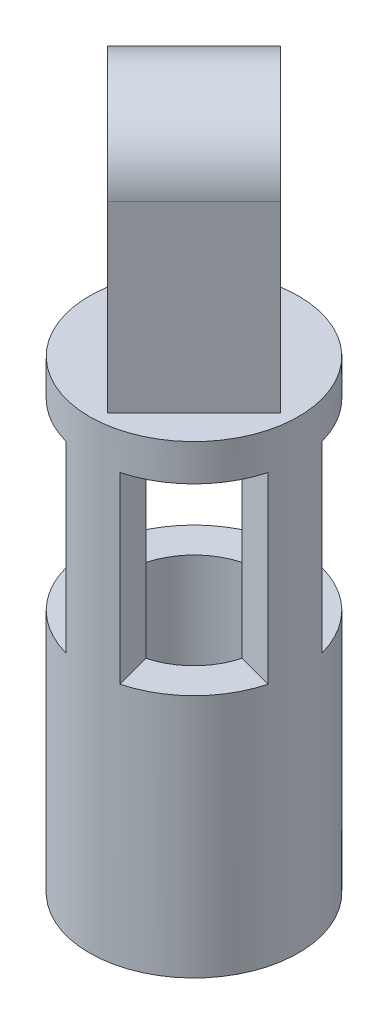
from build123d import *
from build123d.topology import SkipClean

# Parameters (mm, degrees)
SKETCH_4_R      = 8.55
SKETCH_4_R_2    = 5.55
EXTRUDE_1_DEPTH = 20
EXTRUDE_2_DEPTH = 15
SKETCH_6_R      = 8.55
EXTRUDE_3_DEPTH = 3
SKETCH_9_R      = 2
EXTRUDE_4_DEPTH = 5


with BuildPart() as part:
    # Эскиз4 → Бобышка-Вытянуть1 (new body)
    with BuildSketch(Plane(origin=(0, 0, 0), x_dir=(1, 0, 0), z_dir=(0, 1, 0))):
        with Locations(Location((0, 0, 0), (0, 0, 270))):
            Circle(SKETCH_4_R)
        with Locations(Location((0, 0, 0), (0, 0, 270))):
            Circle(SKETCH_4_R_2, mode=Mode.SUBTRACT)
    extrude(amount=EXTRUDE_1_DEPTH)

    # Эскиз5 → Бобышка-Вытянуть2 (add)
    with SkipClean():  # the faces are left unmerged after this step: merging them gives an invalid solid
        with BuildSketch(Plane(origin=(0, 20, 0), x_dir=(1, 0, 0), z_dir=(0, 1, 0))):
            with BuildLine():
                Line((2.212902836, 8.258665815), (1.4364457, 5.360888336))
                ThreePointArc((1.4364457, 5.360888336), (0, 5.55), (-1.4364457, 5.360888336))
                Line((-1.4364457, 5.360888336), (-2.212902836, 8.258665815))
                ThreePointArc((-2.212902836, 8.258665815), (0, 8.55), (2.212902836, 8.258665815))
            make_face()
            with BuildLine():
                Line((8.258665815, -2.212902836), (5.360888336, -1.4364457))
                ThreePointArc((5.360888336, -1.4364457), (5.55, 0), (5.360888336, 1.4364457))
                Line((5.360888336, 1.4364457), (8.258665815, 2.212902836))
                ThreePointArc((8.258665815, 2.212902836), (8.55, 0), (8.258665815, -2.212902836))
            make_face()
            with BuildLine():
                Line((-2.212902836, -8.258665815), (-1.4364457, -5.360888336))
                ThreePointArc((-1.4364457, -5.360888336), (0, -5.55), (1.4364457, -5.360888336))
                Line((1.4364457, -5.360888336), (2.212902836, -8.258665815))
                ThreePointArc((2.212902836, -8.258665815), (0, -8.55), (-2.212902836, -8.258665815))
            make_face()
            with BuildLine():
                Line((-8.258665815, 2.212902836), (-5.360888336, 1.4364457))
                ThreePointArc((-5.360888336, 1.4364457), (-5.55, 0), (-5.360888336, -1.4364457))
                Line((-5.360888336, -1.4364457), (-8.258665815, -2.212902836))
                ThreePointArc((-8.258665815, -2.212902836), (-8.55, 0), (-8.258665815, 2.212902836))
            make_face()
        extrude(amount=EXTRUDE_2_DEPTH)

    # Эскиз6 → Бобышка-Вытянуть3 (add)
    with SkipClean():  # the faces are left unmerged after this step: merging them gives an invalid solid
        with BuildSketch(Plane(origin=(0, 35, 0), x_dir=(1, 0, 0), z_dir=(0, 1, 0))):
            with Locations(Location((0, 0, 0), (0, 0, 270))):
                Circle(SKETCH_6_R)
        extrude(amount=EXTRUDE_3_DEPTH)

    # Эскиз9 → Бобышка-Вытянуть4 (add, symmetric)
    with SkipClean():  # the faces are left unmerged after this step: merging them gives an invalid solid
        with BuildSketch(Plane(origin=(0, 0, 0), x_dir=(0.7071067811865477, 0, 0.7071067811865475), z_dir=(-0.7071067811865475, 0, 0.7071067811865477))):
            with BuildLine():
                Line((-5.7, 38), (-5.7, 53))
                ThreePointArc((-5.7, 53), (0, 58.7), (5.7, 53))
                Line((5.7, 53), (5.7, 38))
                Line((5.7, 38), (0, 38))
                Line((0, 38), (-5.7, 38))
            make_face()
            with Locations((0, 53)):
                Circle(SKETCH_9_R, mode=Mode.SUBTRACT)
        extrude(amount=EXTRUDE_4_DEPTH, both=True)


solid = part.part
